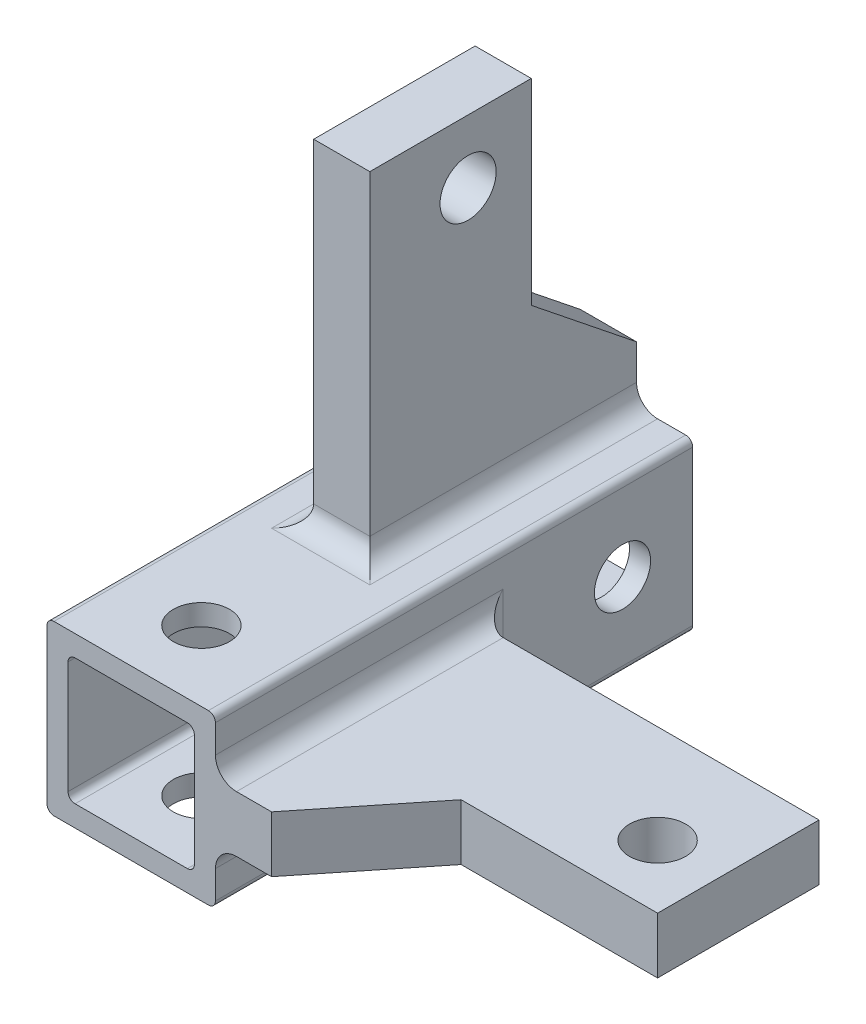
from build123d import *

# Parameters (mm, degrees)
SKETCH1_W          = 76.2
SKETCH1_H          = 76.2
SKETCH1_W_2        = 57.15
SKETCH1_H_2        = 57.15
EXTRUDE1_DEPTH     = 107.95
SKETCH2_R          = 12.7
CUT_EXTRUDE1_DEPTH = 138.518189706
SKETCH3_R          = 12.7
CUT_EXTRUDE2_DEPTH = 138.518189706
SKETCH4_R          = 12.7
EXTRUDE2_DEPTH     = 12.7
SKETCH5_R          = 12.7
EXTRUDE3_DEPTH     = 12.7
FILLET1_R          = 9.525
FILLET2_R          = 3.175


with BuildPart() as part:
    # Sketch1 → Extrude1 (new, symmetric)
    with BuildSketch(Plane.XY):
        Rectangle(SKETCH1_W, SKETCH1_H)
        Rectangle(SKETCH1_W_2, SKETCH1_H_2, mode=Mode.SUBTRACT)
    extrude(amount=EXTRUDE1_DEPTH, both=True)

    # Sketch2 → Cut-Extrude1 (cut, through all)
    with BuildSketch(Plane(origin=(0, 38.1, 0), x_dir=(-1, 0, 0), z_dir=(0, 1, 0))):
        with Locations((0, 76.2)):
            Circle(SKETCH2_R)
    extrude(amount=-CUT_EXTRUDE1_DEPTH, mode=Mode.SUBTRACT)

    # Sketch3 → Cut-Extrude2 (cut, through all)
    with BuildSketch(Plane.ZY.offset(38.1)):
        with Locations(Location((-76.2, 0, 0), (0, 0, 270))):
            Circle(SKETCH3_R)
    extrude(amount=-CUT_EXTRUDE2_DEPTH, mode=Mode.SUBTRACT)

    # Sketch4 → Extrude2 (add, symmetric)
    with BuildSketch(Plane(origin=(0, 0, 0), x_dir=(0, 0, -1), z_dir=(1, 0, 0))):
        Polygon((-12.7, 38.1), (107.95, 38.1), (107.95, 63.5), (60.325, 101.6), (60.325, 190.5), (-12.7, 190.5), align=None)
        with Locations((31.75, 161.925)):
            Circle(SKETCH4_R, mode=Mode.SUBTRACT)
    extrude(amount=EXTRUDE2_DEPTH, both=True)

    # Sketch5 → Extrude3 (add, symmetric)
    with BuildSketch(Plane(origin=(0, 0, 0), x_dir=(1, 0, 0), z_dir=(0, 1, 0))):
        Polygon((38.1, 12.7), (38.1, -107.95), (63.5, -107.95), (101.6, -60.325), (190.5, -60.325), (190.5, 12.7), align=None)
        with Locations(Location((161.925, -31.75, 0), (0, 0, 270))):
            Circle(SKETCH5_R, mode=Mode.SUBTRACT)
    extrude(amount=EXTRUDE3_DEPTH, both=True)

    # Fillet1
    fillet1_edges = [part.edges().sort_by_distance(p)[0] for p in [
        (12.7, 38.1, -47.625),
        (-12.7, 38.1, -47.625),
        (0, 38.1, 12.7),
        (38.1, 12.7, 47.625),
        (38.1, -12.7, 47.625),
        (38.1, 0, -12.7),
    ]]
    fillet(fillet1_edges, radius=FILLET1_R)

    # Fillet2
    fillet2_edges = [part.edges().sort_by_distance(p)[0] for p in [
        (-28.575, 28.575, 0),
        (-28.575, -28.575, 0),
        (28.575, -28.575, 0),
        (28.575, 28.575, 0),
        (-38.1, 38.1, 0),
        (38.1, 38.1, 0),
        (38.1, -38.1, 0),
        (-38.1, -38.1, 0),
    ]]
    fillet(fillet2_edges, radius=FILLET2_R)


solid = part.part
